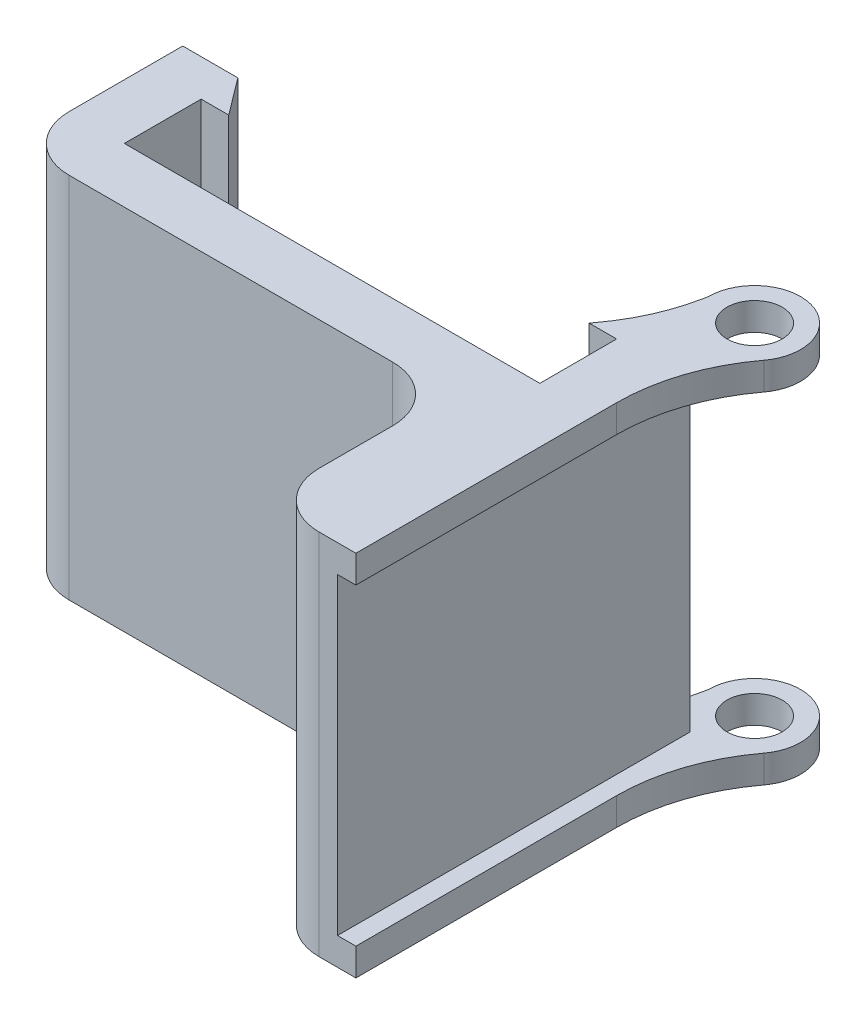
from build123d import *

# Parameters (mm, degrees)
SKETCH1_W           = 28.59
SKETCH1_H           = 20
BOSS_EXTRUDE1_DEPTH = 3
SKETCH2_W           = 3
SKETCH2_H           = 20
BOSS_EXTRUDE2_DEPTH = 6.175
BOSS_EXTRUDE3_DEPTH = 20
SKETCH5_W           = 5
SKETCH5_H           = 20
BOSS_EXTRUDE4_DEPTH = 10
BOSS_EXTRUDE5_DEPTH = 1.5
BOSS_EXTRUDE6_START = -1.5
BOSS_EXTRUDE6_DEPTH = 1.5
CUT_EXTRUDE1_START  = -20
SKETCH8_R           = 1.5
CUT_EXTRUDE1_DEPTH  = 20
SKETCH9_W           = 19.175
SKETCH9_H           = 17
CUT_EXTRUDE2_DEPTH  = 1
FILLET1_R           = 10
FILLET2_R           = 10
FILLET3_R           = 3


with BuildPart() as part:
    # Sketch1 → Boss-Extrude1 (new body)
    with BuildSketch(Plane.XY.offset(24.175)):
        with Locations((0, 65.691967044)):
            Rectangle(SKETCH1_W, SKETCH1_H)
    extrude(amount=BOSS_EXTRUDE1_DEPTH)

    # Sketch2 → Boss-Extrude2 (add)
    with BuildSketch(Plane(origin=(0, 0, 24.175), x_dir=(-1, 0, 0), z_dir=(0, 0, -1))):
        with Locations((-12.795, 65.691967044)):
            Rectangle(SKETCH2_W, SKETCH2_H)
        with Locations((12.795, 65.691967044)):
            Rectangle(SKETCH2_W, SKETCH2_H)
    extrude(amount=BOSS_EXTRUDE2_DEPTH)

    # Sketch4 → Boss-Extrude3 (add)
    with BuildSketch(Plane(origin=(0, 75.691967044, 0), x_dir=(1, 0, 0), z_dir=(0, 1, 0))):
        Polygon((-11.295, -20), (-11.295, -18), (-9.795, -20), align=None)
        Polygon((11.295, -18), (11.295, -20), (9.795, -20), align=None)
    extrude(amount=-BOSS_EXTRUDE3_DEPTH)

    # Sketch5 → Boss-Extrude4 (add)
    with BuildSketch(Plane.XY.offset(27.175)):
        with Locations((11.795, 65.691967044)):
            Rectangle(SKETCH5_W, SKETCH5_H)
    extrude(amount=BOSS_EXTRUDE4_DEPTH)

    # Sketch6 → Boss-Extrude5 (add)
    with BuildSketch(Plane.XZ.offset(-55.691967044)):
        with BuildLine():
            Line((11.295, 18), (11.795, 15.5))
            ThreePointArc((11.795, 15.5), (16.062766953, 13.732233047), (14.295, 18))
            Line((14.295, 18), (11.295, 18))
        make_face()
    extrude(amount=-BOSS_EXTRUDE5_DEPTH)

    # Sketch7 → Boss-Extrude6 (add)
    with BuildSketch(Plane(origin=(0, 75.691967044, 0), x_dir=(1, 0, 0), z_dir=(0, 1, 0)).offset(BOSS_EXTRUDE6_START)):
        with BuildLine():
            Line((11.295, -18), (11.795, -15.5))
            ThreePointArc((11.795, -15.5), (16.062766953, -13.732233047), (14.295, -18))
            Line((14.295, -18), (11.295, -18))
        make_face()
    extrude(amount=BOSS_EXTRUDE6_DEPTH)

    # Sketch8 → Cut-Extrude1 (cut)
    with BuildSketch(Plane(origin=(0, 75.691967044, 0), x_dir=(1, 0, 0), z_dir=(0, 1, 0)).offset(CUT_EXTRUDE1_START)):
        with Locations(Location((14.295, -15.5, 0), (0, 0, 270))):
            Circle(SKETCH8_R)
    extrude(amount=CUT_EXTRUDE1_DEPTH, mode=Mode.SUBTRACT)

    # Sketch9 → Cut-Extrude2 (cut)
    with BuildSketch(Plane(origin=(14.295, 0, 0), x_dir=(0, 0, -1), z_dir=(1, 0, 0))):
        with Locations((-27.5875, 65.691967044)):
            Rectangle(SKETCH9_W, SKETCH9_H)
    extrude(amount=-CUT_EXTRUDE2_DEPTH, mode=Mode.SUBTRACT)

    # Fillet1
    fillet1_edges = [part.edges().sort_by_distance(p)[0] for p in [
        (14.295, 74.941967044, 18),
        (14.295, 56.441967044, 18),
    ]]
    fillet(fillet1_edges, radius=FILLET1_R)

    # Fillet2
    fillet2_edges = [part.edges().sort_by_distance(p)[0] for p in [
        (11.295, 74.941967044, 18),
        (11.295, 56.441967044, 18),
    ]]
    fillet(fillet2_edges, radius=FILLET2_R)

    # Fillet3
    fillet3_edges = [part.edges().sort_by_distance(p)[0] for p in [
        (-14.295, 65.691967044, 27.175),
        (9.295, 65.691967044, 27.175),
        (9.295, 65.691967044, 37.175),
    ]]
    fillet(fillet3_edges, radius=FILLET3_R)


solid = part.part
